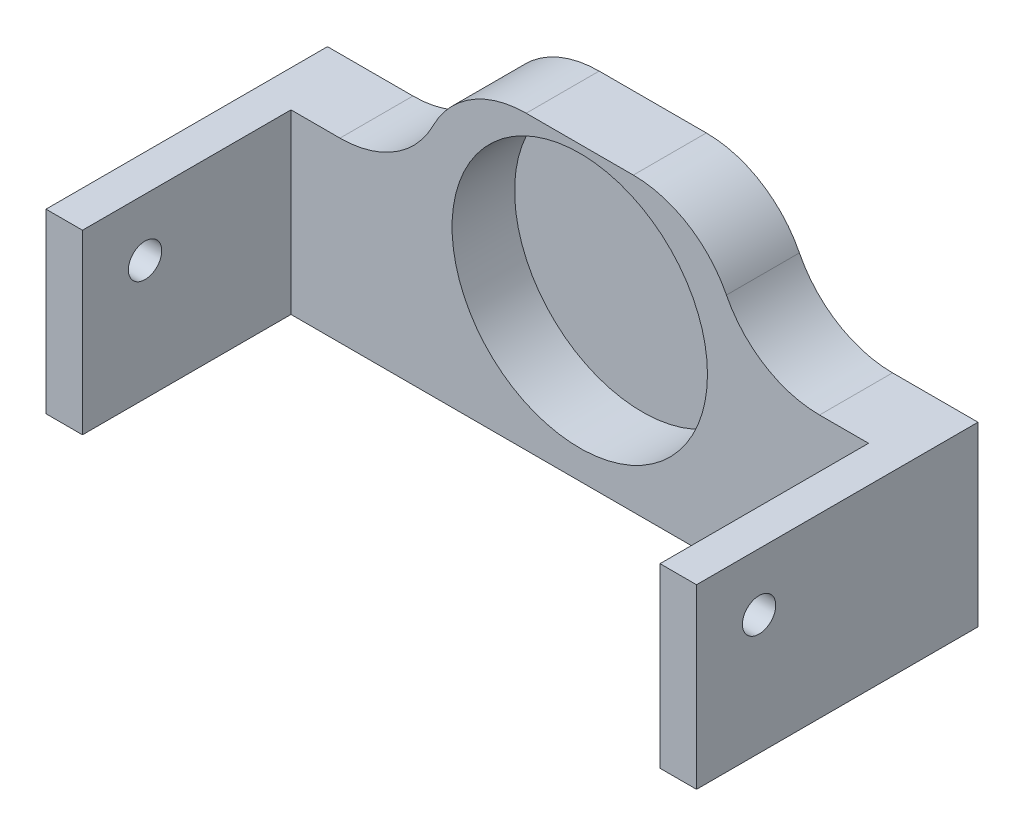
from build123d import *

# Parameters (mm, degrees)
SKETCH1_W           = 62.4
SKETCH1_H           = 28
BOSS_EXTRUDE2_DEPTH = 7
SKETCH3_R           = 12.25
CUT_EXTRUDE2_DEPTH  = 6
CUT_EXTRUDE3_REACH  = 53.513
SKETCH4_W           = 18.2
SKETCH4_H           = 11
FILLET1_R           = 10
FILLET2_R           = 10
SKETCH5_W           = 3.5
SKETCH5_H           = 17
BOSS_EXTRUDE3_DEPTH = 20
SKETCH6_R           = 1.6
CUT_EXTRUDE4_DEPTH  = 72.38585011


with BuildPart() as part:
    # Sketch1 → Boss-Extrude2 (new body)
    with BuildSketch(Plane.XY):
        with Locations((14.966835682, -7.752691308)):
            Rectangle(SKETCH1_W, SKETCH1_H)
    extrude(amount=BOSS_EXTRUDE2_DEPTH)

    # Sketch3 → Cut-Extrude2 (cut)
    with BuildSketch(Plane.XY.offset(7)):
        with Locations((14.966835682, -6.752691308)):
            Circle(SKETCH3_R)
    extrude(amount=-CUT_EXTRUDE2_DEPTH, mode=Mode.SUBTRACT)

    # Sketch4 → Cut-Extrude3 (cut, up to next)
    with BuildSketch(Plane.XY.offset(7), mode=Mode.PRIVATE) as cut_extrude3_sk1:
        with Locations((-7.133164318, 0.747308692)):
            Rectangle(SKETCH4_W, SKETCH4_H)
    cut_extrude3_tool1 = extrude(cut_extrude3_sk1.sketch, amount=-CUT_EXTRUDE3_REACH, mode=Mode.PRIVATE) & part.part
    # Sketch4 → Cut-Extrude3 (cut, up to next)
    with BuildSketch(Plane.XY.offset(7), mode=Mode.PRIVATE) as cut_extrude3_sk2:
        with Locations((37.066835682, 0.747308692)):
            Rectangle(SKETCH4_W, SKETCH4_H)
    cut_extrude3_tool2 = extrude(cut_extrude3_sk2.sketch, amount=-CUT_EXTRUDE3_REACH, mode=Mode.PRIVATE) & part.part
    add(cut_extrude3_tool1.solids().sort_by_distance((-7.133164, 0.747309, 7))[0], mode=Mode.SUBTRACT)
    add(cut_extrude3_tool2.solids().sort_by_distance((37.066836, 0.747309, 7))[0], mode=Mode.SUBTRACT)

    # Fillet1
    fillet1_edges = [part.edges().sort_by_distance(p)[0] for p in [
        (1.966835682, -4.752691308, 3.5),
        (27.966835682, -4.752691308, 3.5),
    ]]
    fillet(fillet1_edges, radius=FILLET1_R)

    # Fillet2
    fillet2_edges = [part.edges().sort_by_distance(p)[0] for p in [
        (27.966835682, 6.247308692, 3.5),
        (1.966835682, 6.247308692, 3.5),
    ]]
    fillet(fillet2_edges, radius=FILLET2_R)

    # Sketch5 → Boss-Extrude3 (add)
    with BuildSketch(Plane.XY.offset(7)):
        with Locations((-14.483164318, -13.252691308)):
            Rectangle(SKETCH5_W, SKETCH5_H)
        with Locations((44.416835682, -13.252691308)):
            Rectangle(SKETCH5_W, SKETCH5_H)
    extrude(amount=BOSS_EXTRUDE3_DEPTH)

    # Sketch6 → Cut-Extrude4 (cut, through all)
    with BuildSketch(Plane.ZY.offset(16.233164318)):
        with Locations(Location((21, -10.252691308, 0), (0, 0, 270))):
            Circle(SKETCH6_R)
    extrude(amount=-CUT_EXTRUDE4_DEPTH, mode=Mode.SUBTRACT)


solid = part.part
